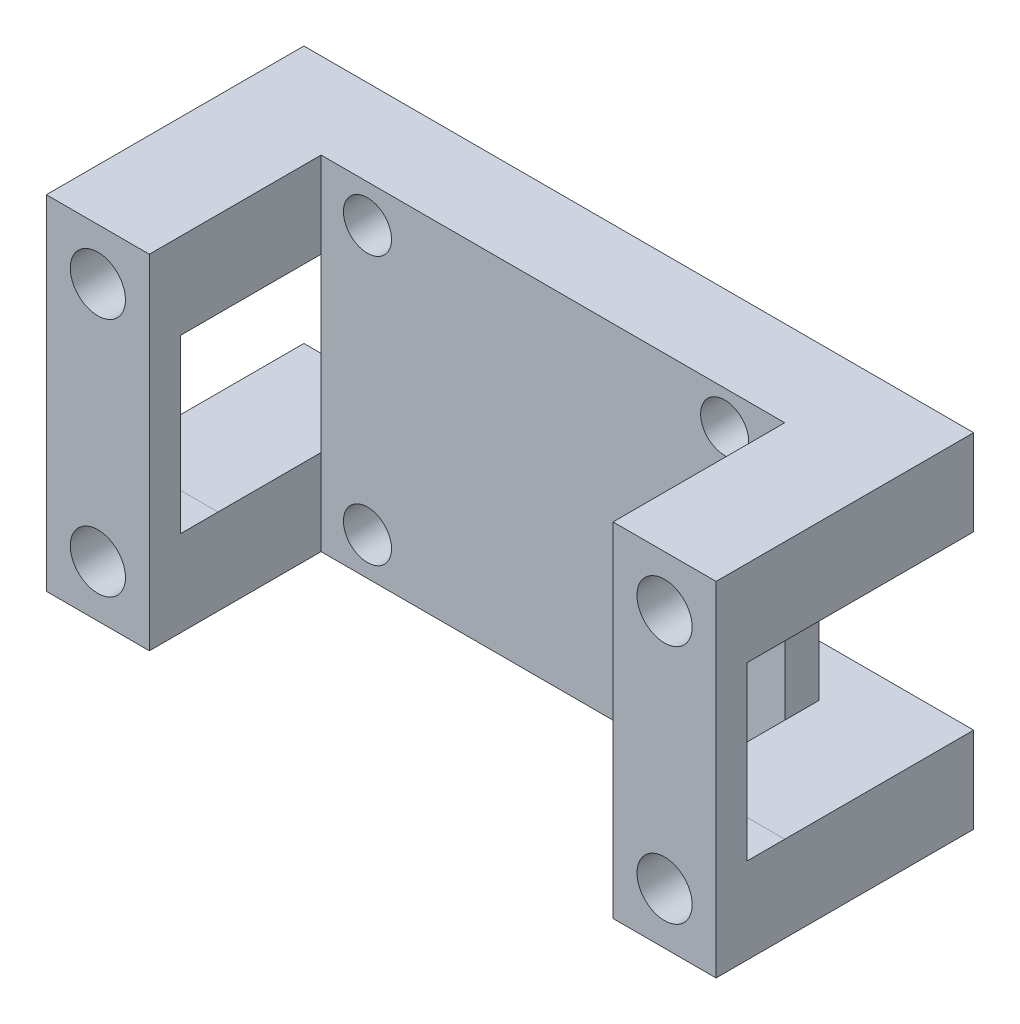
from build123d import *

# Parameters (mm, degrees)
SKETCH1_W               = 34.29
SKETCH1_H               = 25.4
BOSS_EXTRUDE1_DEPTH     = 2.54
SKETCH3_W               = 49.53
SKETCH3_H               = 6.35
BOSS_EXTRUDE2_DEPTH     = 3.81
CUT_EXTRUDE1_DEPTH      = 50.415894204
CUT_EXTRUDE1_DEPTH_BACK = 50.415894204
SKETCH2_R               = 1.778
SKETCH5_W               = 7.62
SKETCH5_H               = 6.35
BOSS_EXTRUDE3_DEPTH     = 15.24
BOSS_EXTRUDE4_REACH     = 53.321
SKETCH6_W               = 7.62
SKETCH6_H               = 5.08
SKETCH7_R               = 2.04
SKETCH7_R_2             = 2.039999984
CUT_EXTRUDE2_DEPTH      = 53.578613523
SKETCH9_W               = 2.794
SKETCH9_H               = 12.699691263
CUT_EXTRUDE3_DEPTH      = 58.711684259


with BuildPart() as part:
    # Sketch1 → Boss-Extrude1 (new body)
    with BuildSketch(Plane.XY):
        with Locations((17.145, 12.7)):
            Rectangle(SKETCH1_W, SKETCH1_H)
    extrude(amount=BOSS_EXTRUDE1_DEPTH)

    # Sketch3 → Boss-Extrude2 (add)
    with BuildSketch(Plane(origin=(0, 0, 0), x_dir=(-1, 0, 0), z_dir=(0, 0, -1))):
        with Locations((-17.145, 22.225)):
            Rectangle(SKETCH3_W, SKETCH3_H)
        with Locations((-17.145, 3.175)):
            Rectangle(SKETCH3_W, SKETCH3_H)
    extrude(amount=BOSS_EXTRUDE2_DEPTH)

    # Sketch2 → Cut-Extrude1 (cut, two sides: drawn at the far end of the back side and taken through both)
    with BuildSketch(Plane.XY.offset(2.54).offset(-CUT_EXTRUDE1_DEPTH_BACK)):
        with Locations((3.429, 22.606)):
            Circle(SKETCH2_R)
        with Locations((29.845, 22.86)):
            Circle(SKETCH2_R)
        with Locations((3.429, 2.794)):
            Circle(SKETCH2_R)
        with Locations((29.845, 2.286)):
            Circle(SKETCH2_R)
    extrude(amount=CUT_EXTRUDE1_DEPTH + CUT_EXTRUDE1_DEPTH_BACK, mode=Mode.SUBTRACT)

    # Sketch5 → Boss-Extrude3 (add)
    with BuildSketch(Plane.XY):
        with Locations((-3.81, 22.225)):
            Rectangle(SKETCH5_W, SKETCH5_H)
        with Locations((38.1, 22.225)):
            Rectangle(SKETCH5_W, SKETCH5_H)
        with Locations((38.1, 3.175)):
            Rectangle(SKETCH5_W, SKETCH5_H)
        with Locations((-3.81, 3.175)):
            Rectangle(SKETCH5_W, SKETCH5_H)
    extrude(amount=BOSS_EXTRUDE3_DEPTH)

    # Sketch6 → Boss-Extrude4 (add, up to next)
    with BuildSketch(Plane.XZ, mode=Mode.PRIVATE) as boss_extrude4_sk1:
        with Locations((-3.81, 12.7)):
            Rectangle(SKETCH6_W, SKETCH6_H)
    boss_extrude4_tool1 = extrude(boss_extrude4_sk1.sketch, amount=-BOSS_EXTRUDE4_REACH, mode=Mode.PRIVATE) - part.part
    # Sketch6 → Boss-Extrude4 (add, up to next)
    with BuildSketch(Plane.XZ, mode=Mode.PRIVATE) as boss_extrude4_sk2:
        with Locations((38.1, 12.7)):
            Rectangle(SKETCH6_W, SKETCH6_H)
    boss_extrude4_tool2 = extrude(boss_extrude4_sk2.sketch, amount=-BOSS_EXTRUDE4_REACH, mode=Mode.PRIVATE) - part.part
    add(boss_extrude4_tool1.solids().sort_by_distance((-3.81, 0, 12.7))[0])
    add(boss_extrude4_tool2.solids().sort_by_distance((38.1, 0, 12.7))[0])

    # Sketch7 → Cut-Extrude2 (cut, through all)
    with BuildSketch(Plane.XY.offset(15.24)):
        with Locations((38.1, 3.81)):
            Circle(SKETCH7_R)
        with Locations((38.1, 21.59)):
            Circle(SKETCH7_R_2)
        with Locations((-3.81, 3.81)):
            Circle(SKETCH7_R_2)
        with Locations((-3.81, 21.59)):
            Circle(SKETCH7_R_2)
    extrude(amount=-CUT_EXTRUDE2_DEPTH, mode=Mode.SUBTRACT)

    # Sketch9 → Cut-Extrude3 (cut, through all)
    with BuildSketch(Plane.ZY.offset(7.62)):
        with Locations((11.557, 12.700154369)):
            Rectangle(SKETCH9_W, SKETCH9_H)
    extrude(amount=-CUT_EXTRUDE3_DEPTH, mode=Mode.SUBTRACT)


solid = part.part
